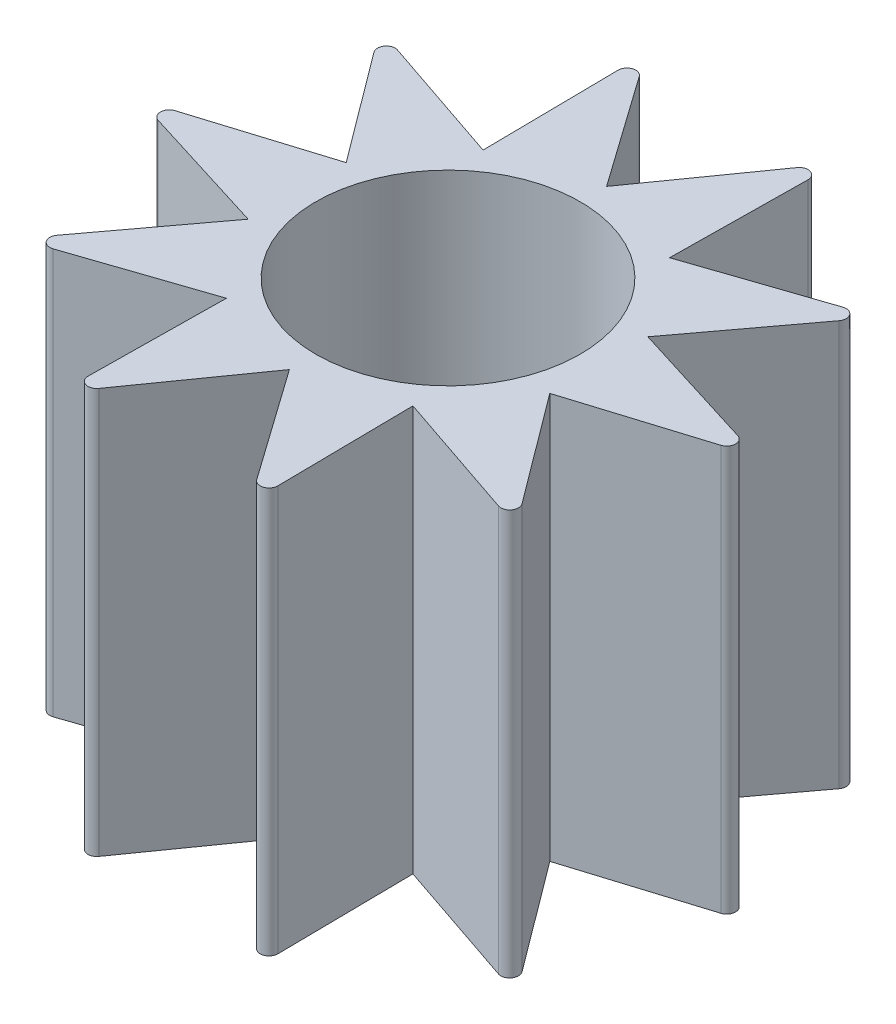
from build123d import *

# Parameters (mm, degrees)
SKETCH_1_R          = 1.75
EXTRUDE_1_DEPTH     = 2.3
SKETCH_2_OUTSIDE_W  = 6.592
SKETCH_2_OUTSIDE_H  = 6.592
SKETCH_2_OUTSIDE_R  = 0.75
CUT_EXTRUDE_2_DEPTH = 2.3


with BuildPart() as part:
    # 草圖1 → 伸長1 (new body)
    with BuildSketch(Plane(origin=(0, 0, 0), x_dir=(1, 0, 0), z_dir=(0, 1, 0))):
        with Locations(Location((0, 0, 0), (0, 0, 270))):
            Circle(SKETCH_1_R)
    extrude(amount=EXTRUDE_1_DEPTH)

    # 草圖2 outside → 伸長2 (cut)
    # profile 1 of 2: a face of its own
    with BuildSketch(Plane(origin=(0, 2.3, 0), x_dir=(1, 0, 0), z_dir=(0, 1, 0))):
        Rectangle(SKETCH_2_OUTSIDE_W, SKETCH_2_OUTSIDE_H)
        with BuildLine():
            Line((0.529006727, 0.728115295), (0.538758697, 1.503628067))
            ThreePointArc((0.538758697, 1.503628067), (0.504213499, 1.551809586), (0.447945461, 1.533135076))
            Line((0.447945461, 1.533135076), (0, 0.9))
            Line((0, 0.9), (-0.447945461, 1.533135076))
            ThreePointArc((-0.447945461, 1.533135076), (-0.504213499, 1.551809586), (-0.538758697, 1.503628067))
            Line((-0.538758697, 1.503628067), (-0.529006727, 0.728115295))
            Line((-0.529006727, 0.728115295), (-1.263549678, 0.977036595))
            ThreePointArc((-1.263549678, 0.977036595), (-1.320048079, 0.959071069), (-1.319675344, 0.899786243))
            Line((-1.319675344, 0.899786243), (-0.855950865, 0.278115295))
            Line((-0.855950865, 0.278115295), (-1.596520864, 0.047743344))
            ThreePointArc((-1.596520864, 0.047743344), (-1.631669159, 0), (-1.596520864, -0.047743344))
            Line((-1.596520864, -0.047743344), (-0.855950865, -0.278115295))
            Line((-0.855950865, -0.278115295), (-1.319675344, -0.899786243))
            ThreePointArc((-1.319675344, -0.899786243), (-1.320048079, -0.959071069), (-1.263549678, -0.977036595))
            Line((-1.263549678, -0.977036595), (-0.529006727, -0.728115295))
            Line((-0.529006727, -0.728115295), (-0.538758697, -1.503628067))
            ThreePointArc((-0.538758697, -1.503628067), (-0.504213499, -1.551809586), (-0.447945461, -1.533135076))
            Line((-0.447945461, -1.533135076), (0, -0.9))
            Line((0, -0.9), (0.447945461, -1.533135076))
            ThreePointArc((0.447945461, -1.533135076), (0.504213499, -1.551809586), (0.538758697, -1.503628067))
            Line((0.538758697, -1.503628067), (0.529006727, -0.728115295))
            Line((0.529006727, -0.728115295), (1.263549678, -0.977036595))
            ThreePointArc((1.263549678, -0.977036595), (1.320048079, -0.959071069), (1.319675344, -0.899786243))
            Line((1.319675344, -0.899786243), (0.855950865, -0.278115295))
            Line((0.855950865, -0.278115295), (1.596520864, -0.047743344))
            ThreePointArc((1.596520864, -0.047743344), (1.631669159, 0), (1.596520864, 0.047743344))
            Line((1.596520864, 0.047743344), (0.855950865, 0.278115295))
            Line((0.855950865, 0.278115295), (1.319675344, 0.899786243))
            ThreePointArc((1.319675344, 0.899786243), (1.320048079, 0.959071069), (1.263549678, 0.977036595))
            Line((1.263549678, 0.977036595), (0.529006727, 0.728115295))
        make_face(mode=Mode.SUBTRACT)
    # profile 2 of 2: a face of its own
    with BuildSketch(Plane(origin=(0, 2.3, 0), x_dir=(1, 0, 0), z_dir=(0, 1, 0))):
        with Locations(Location((0, 0, 0), (0, 0, 270))):
            Circle(SKETCH_2_OUTSIDE_R)
    extrude(amount=-CUT_EXTRUDE_2_DEPTH, mode=Mode.SUBTRACT)


solid = part.part
